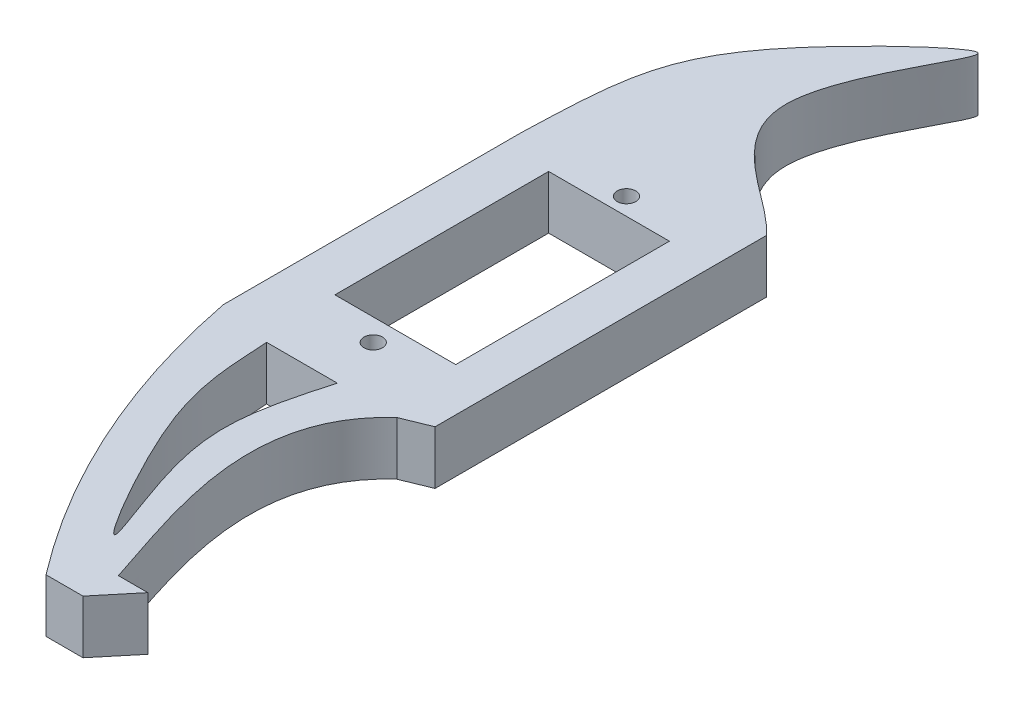
from build123d import *

# Parameters (mm, degrees)
SKETCH2_W             = 40
SKETCH2_H             = 80
BOSS_EXTRUDE1_DEPTH   = 20
SCALE1_SCALE          = 0.2875
KES_EKSTR_ZYON1_REACH = 115.922
IZIM1_W               = 0.75
IZIM1_H               = 23
KES_EKSTR_ZYON2_REACH = 115.922
IZIM3_R               = 1


with BuildPart() as part:
    # Sketch2 → Boss-Extrude1 (new body)
    with BuildSketch(Plane(origin=(0, 0, 0), x_dir=(1, 0, 0), z_dir=(0, 1, 0))):
        with BuildLine():
            Line((91.748029948, 286.105642268), (91.748029948, 162.093779745))
            Line((91.748029948, 162.093779745), (81.603228429, 157.943633669))
            add(Edge.make_bspline(
                [(81.603228429, 157.943633669), (51.489793615, 130.883091402), (71.077374418, 84.67635543), (80.737452345, 54.568813968)],
                knots=[0, 0, 0, 0, 1, 1, 1, 1], degree=3))
            Line((80.737452345, 54.568813968), (91.748029948, 54.568813968))
            Line((91.748029948, 54.568813968), (80.737452345, 41.31547989))
            Line((80.737452345, 41.31547989), (66.901900414, 41.31547989))
            add(Edge.make_bspline(
                [(12.525657655, 162.093779745), (25.626950364, 95.350075052), (66.901900414, 41.31547989)],
                knots=[0, 0, 0, 1, 1, 1], degree=2))
            Line((12.525657655, 162.093779745), (12.525657655, 273.690898415))
            add(Edge.make_bspline(
                [(91.748029948, 286.105642268), (79.922391143, 299.355207446), (28.259694552, 319.457640261), (93.257406433, 407.769132645), (14.48793498, 335.732868197), (13.834951141, 311.359487285), (12.525657655, 273.690898415)],
                knots=[0, 0, 0, 0, 0.243535756, 0.469285781, 0.650563804, 1, 1, 1, 1], degree=3))
        make_face()
        with BuildLine():
            Line((32.841808935, 157.943633669), (59.288509333, 157.943633669))
            add(Edge.make_bspline(
                [(59.288509333, 157.943633669), (52.906047197, 134.658803414), (47.730353034, 114.952987706), (77.217062601, 45.903290821), (34.907229407, 118.037392866), (33.793918974, 140.224988413), (32.841808935, 157.943633669)],
                knots=[0, 0, 0, 0, 0.317344246, 0.486949249, 0.743913187, 1, 1, 1, 1], degree=3))
        make_face(mode=Mode.SUBTRACT)
        with Locations((52.841808935, 226.116752263)):
            Rectangle(SKETCH2_W, SKETCH2_H, mode=Mode.SUBTRACT)
    extrude(amount=BOSS_EXTRUDE1_DEPTH)


with BuildPart() as part_1:
    # Scale1: scaled about (0, 0, 0)
    add(part.part.scale(SCALE1_SCALE))

    # Çizim1 → Kes-Ekstrüzyon1 (cut, up to next)
    with BuildSketch(Plane(origin=(0, 5.75, 0), x_dir=(1, 0, 0), z_dir=(0, 1, 0)), mode=Mode.PRIVATE) as kes_ekstr_zyon1_sk1:
        with Locations((9.067020069, 65.008566276)):
            Rectangle(IZIM1_W, IZIM1_H)
    kes_ekstr_zyon1_tool1 = extrude(kes_ekstr_zyon1_sk1.sketch, amount=-KES_EKSTR_ZYON1_REACH, mode=Mode.PRIVATE) & part_1.part
    # Çizim1 → Kes-Ekstrüzyon1 (cut, up to next)
    with BuildSketch(Plane(origin=(0, 5.75, 0), x_dir=(1, 0, 0), z_dir=(0, 1, 0)), mode=Mode.PRIVATE) as kes_ekstr_zyon1_sk2:
        with Locations((21.317020069, 65.008566276)):
            Rectangle(IZIM1_W, IZIM1_H)
    kes_ekstr_zyon1_tool2 = extrude(kes_ekstr_zyon1_sk2.sketch, amount=-KES_EKSTR_ZYON1_REACH, mode=Mode.PRIVATE) & part_1.part
    add(kes_ekstr_zyon1_tool1.solids().sort_by_distance((9.06702, 5.75, -65.008566))[0], mode=Mode.SUBTRACT)
    add(kes_ekstr_zyon1_tool2.solids().sort_by_distance((21.31702, 5.75, -65.008566))[0], mode=Mode.SUBTRACT)

    # Çizim3 → Kes-Ekstrüzyon2 (cut, up to next)
    with BuildSketch(Plane(origin=(0, 5.75, 0), x_dir=(1, 0, 0), z_dir=(0, 1, 0)), mode=Mode.PRIVATE) as kes_ekstr_zyon2_sk1:
        with Locations(Location((15.192020069, 51.133566276, 0), (0, 0, 270))):
            Circle(IZIM3_R)
    kes_ekstr_zyon2_tool1 = extrude(kes_ekstr_zyon2_sk1.sketch, amount=-KES_EKSTR_ZYON2_REACH, mode=Mode.PRIVATE) & part_1.part
    # Çizim3 → Kes-Ekstrüzyon2 (cut, up to next)
    with BuildSketch(Plane(origin=(0, 5.75, 0), x_dir=(1, 0, 0), z_dir=(0, 1, 0)), mode=Mode.PRIVATE) as kes_ekstr_zyon2_sk2:
        with Locations(Location((15.192020069, 78.383566276, 0), (0, 0, 270))):
            Circle(IZIM3_R)
    kes_ekstr_zyon2_tool2 = extrude(kes_ekstr_zyon2_sk2.sketch, amount=-KES_EKSTR_ZYON2_REACH, mode=Mode.PRIVATE) & part_1.part
    add(kes_ekstr_zyon2_tool1.solids().sort_by_distance((15.19202, 5.75, -51.133566))[0], mode=Mode.SUBTRACT)
    add(kes_ekstr_zyon2_tool2.solids().sort_by_distance((15.19202, 5.75, -78.383566))[0], mode=Mode.SUBTRACT)


solid = part_1.part
